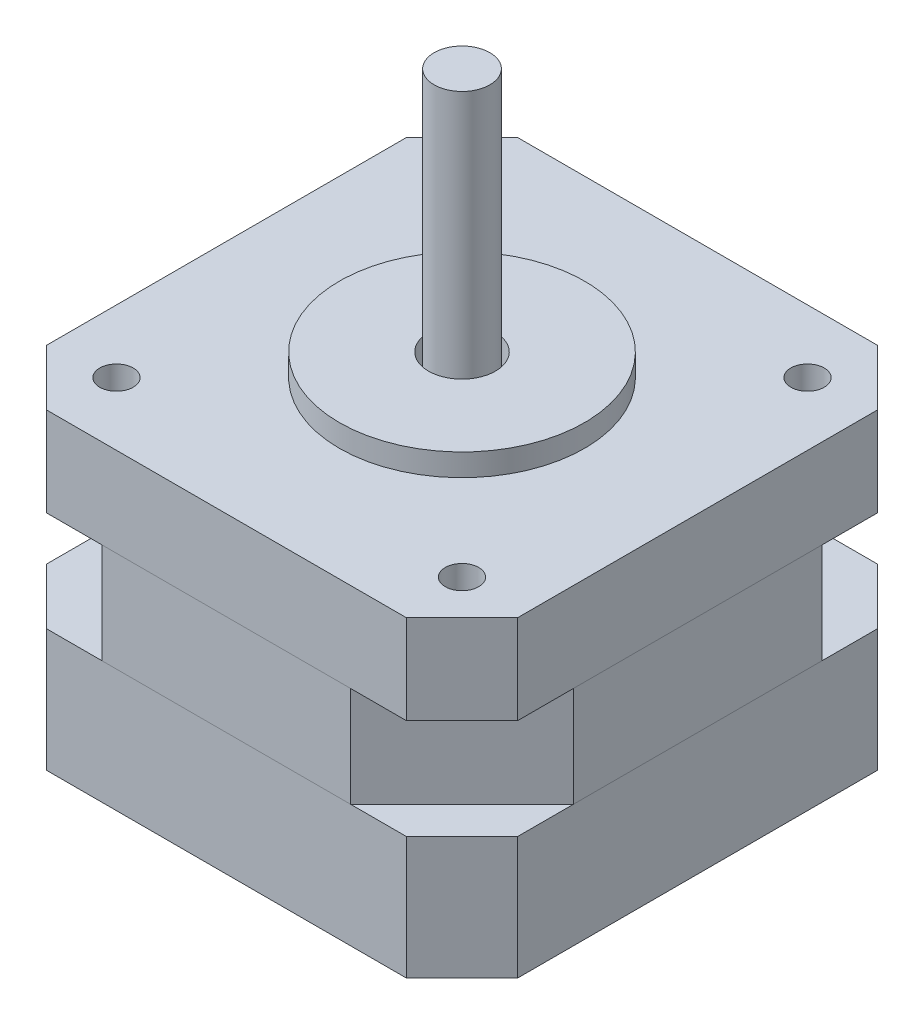
from build123d import *

# Parameters (mm, degrees)
SKETCH1_W           = 42.3
SKETCH1_H           = 42.3
BOSS_EXTRUDE1_DEPTH = 11
SKETCH2_W           = 42.3
SKETCH2_H           = 42.3
BOSS_EXTRUDE2_DEPTH = 9
SKETCH3_W           = 42.3
SKETCH3_H           = 42.3
BOSS_EXTRUDE3_DEPTH = 8
CHAMFER1_SIZE       = 10
CHAMFER2_SIZE       = 5
CHAMFER3_SIZE       = 5
SKETCH4_R           = 11
BOSS_EXTRUDE4_DEPTH = 2
SKETCH5_R           = 3
CUT_EXTRUDE1_DEPTH  = 4
SKETCH6_R           = 2.5
BOSS_EXTRUDE5_DEPTH = 26
SKETCH7_R           = 1.5
CUT_EXTRUDE2_DEPTH  = 4.5


with BuildPart() as part:
    # Sketch1 → Boss-Extrude1 (new body)
    with BuildSketch(Plane(origin=(0, 0, 0), x_dir=(1, 0, 0), z_dir=(0, 1, 0))):
        Rectangle(SKETCH1_W, SKETCH1_H)
    extrude(amount=BOSS_EXTRUDE1_DEPTH)

    # Chamfer3
    chamfer3_edges = [part.edges().sort_by_distance(p)[0] for p in [
        (-21.15, 5.5, -21.15),
        (21.15, 5.5, -21.15),
        (21.15, 5.5, 21.15),
        (-21.15, 5.5, 21.15),
    ]]
    chamfer(chamfer3_edges, length=CHAMFER3_SIZE)


with BuildPart() as body_2:
    # Sketch2 → Boss-Extrude2 (new body)
    with BuildSketch(Plane(origin=(0, 11, 0), x_dir=(1, 0, 0), z_dir=(0, 1, 0))):
        Rectangle(SKETCH2_W, SKETCH2_H)
    extrude(amount=BOSS_EXTRUDE2_DEPTH)

    # Chamfer1
    chamfer1_edges = [body_2.edges().sort_by_distance(p)[0] for p in [
        (-21.15, 15.5, -21.15),
        (21.15, 15.5, -21.15),
        (21.15, 15.5, 21.15),
        (-21.15, 15.5, 21.15),
    ]]
    chamfer(chamfer1_edges, length=CHAMFER1_SIZE)


with BuildPart() as body_3:
    # Sketch3 → Boss-Extrude3 (new body)
    with BuildSketch(Plane(origin=(0, 20, 0), x_dir=(1, 0, 0), z_dir=(0, 1, 0))):
        Rectangle(SKETCH3_W, SKETCH3_H)
    extrude(amount=BOSS_EXTRUDE3_DEPTH)

    # Chamfer2
    chamfer2_edges = [body_3.edges().sort_by_distance(p)[0] for p in [
        (-21.15, 24, -21.15),
        (21.15, 24, -21.15),
        (21.15, 24, 21.15),
        (-21.15, 24, 21.15),
    ]]
    chamfer(chamfer2_edges, length=CHAMFER2_SIZE)

    # Sketch4 → Boss-Extrude4 (add)
    with BuildSketch(Plane(origin=(0, 28, 0), x_dir=(1, 0, 0), z_dir=(0, 1, 0))):
        with Locations(Location((0, 0, 0), (0, 0, 270))):
            Circle(SKETCH4_R)
    extrude(amount=BOSS_EXTRUDE4_DEPTH)

    # Sketch5 → Cut-Extrude1 (cut)
    with BuildSketch(Plane(origin=(0, 30, 0), x_dir=(1, 0, 0), z_dir=(0, 1, 0))):
        with Locations(Location((0, 0, 0), (0, 0, 270))):
            Circle(SKETCH5_R)
    extrude(amount=-CUT_EXTRUDE1_DEPTH, mode=Mode.SUBTRACT)

    # Sketch6 → Boss-Extrude5 (add)
    with BuildSketch(Plane(origin=(0, 26, 0), x_dir=(1, 0, 0), z_dir=(0, 1, 0))):
        with Locations(Location((0, 0, 0), (0, 0, 90))):
            Circle(SKETCH6_R)
    extrude(amount=BOSS_EXTRUDE5_DEPTH)

    # Sketch7 → Cut-Extrude2 (cut)
    with BuildSketch(Plane(origin=(0, 28, 0), x_dir=(1, 0, 0), z_dir=(0, 1, 0))):
        with Locations(Location((-15.5, -15.5, 0), (0, 0, 270))):
            Circle(SKETCH7_R)
        with Locations(Location((-15.5, 15.5, 0), (0, 0, 270))):
            Circle(SKETCH7_R)
        with Locations(Location((15.5, 15.5, 0), (0, 0, 270))):
            Circle(SKETCH7_R)
        with Locations(Location((15.5, -15.5, 0), (0, 0, 270))):
            Circle(SKETCH7_R)
    extrude(amount=-CUT_EXTRUDE2_DEPTH, mode=Mode.SUBTRACT)


solid = Compound([part.part, body_2.part, body_3.part])
